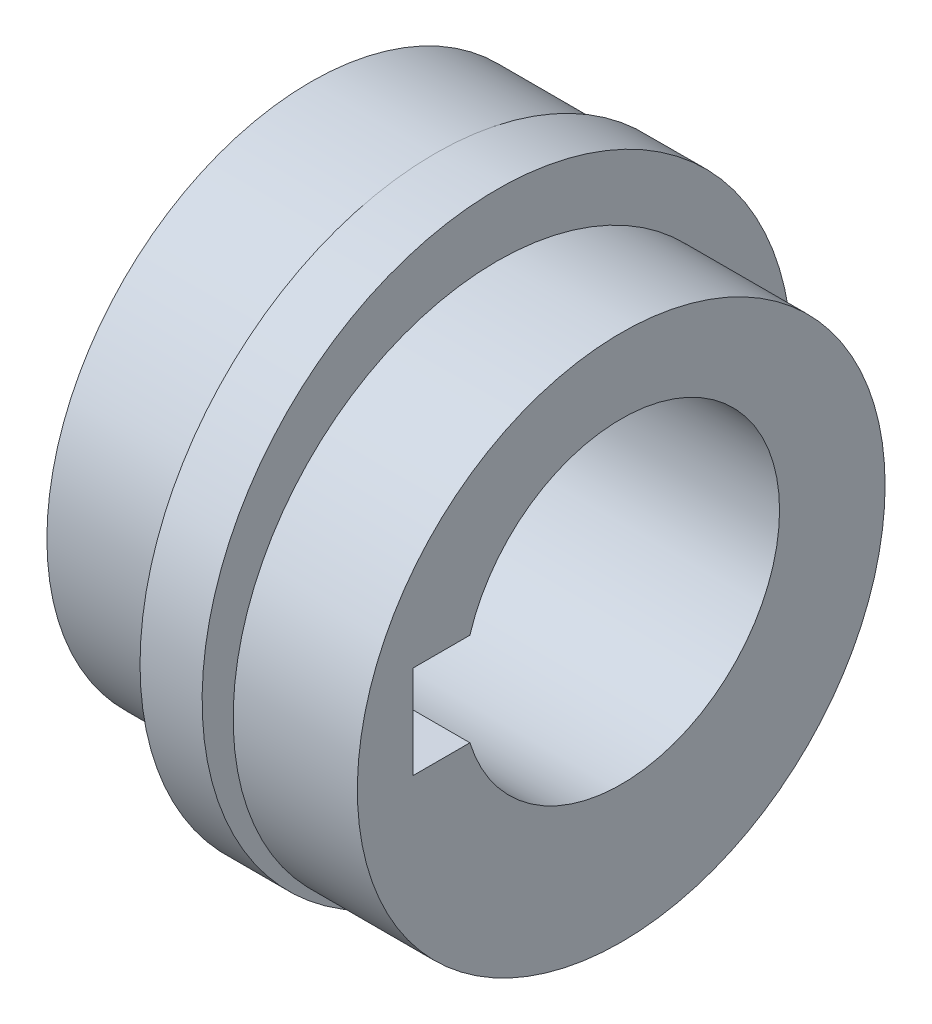
from build123d import *

# Parameters (mm, degrees)
SKETCH1_R           = 9.5
BOSS_EXTRUDE1_DEPTH = 1
SKETCH2_R           = 8.5
BOSS_EXTRUDE3_DEPTH = 4
SKETCH3_R           = 8.5
BOSS_EXTRUDE4_DEPTH = 4
CUT_EXTRUDE1_DEPTH  = 17.748134224


with BuildPart() as part:
    # Sketch1 → Boss-Extrude1 (new, symmetric)
    with BuildSketch(Plane.YZ):
        with Locations(Location((0, 0, 0), (0, 0, 270))):
            Circle(SKETCH1_R)
    extrude(amount=BOSS_EXTRUDE1_DEPTH, both=True)

    # Sketch2 → Boss-Extrude3 (add)
    with BuildSketch(Plane.YZ.offset(1)):
        with Locations(Location((-1, 0, 0), (0, 0, 180))):
            Circle(SKETCH2_R)
    extrude(amount=BOSS_EXTRUDE3_DEPTH)

    # Sketch3 → Boss-Extrude4 (add)
    with BuildSketch(Plane(origin=(-1, 0, 0), x_dir=(0, -1, 0), z_dir=(-1, 0, 0))):
        with Locations(Location((-1, 0, 0), (0, 0, 179.999143376))):
            Circle(SKETCH3_R)
    extrude(amount=BOSS_EXTRUDE4_DEPTH)

    # Sketch4 → Cut-Extrude1 (cut, through all)
    with BuildSketch(Plane.YZ.offset(5)):
        with BuildLine():
            Line((-1.5, 4.874423043), (-1.5, 6.7))
            Line((-1.5, 6.7), (1.5, 6.7))
            Line((1.5, 6.7), (1.5, 4.874423043))
            ThreePointArc((1.5, 4.874423043), (0, -5.1), (-1.5, 4.874423043))
        make_face()
    extrude(amount=-CUT_EXTRUDE1_DEPTH, mode=Mode.SUBTRACT)


solid = part.part
